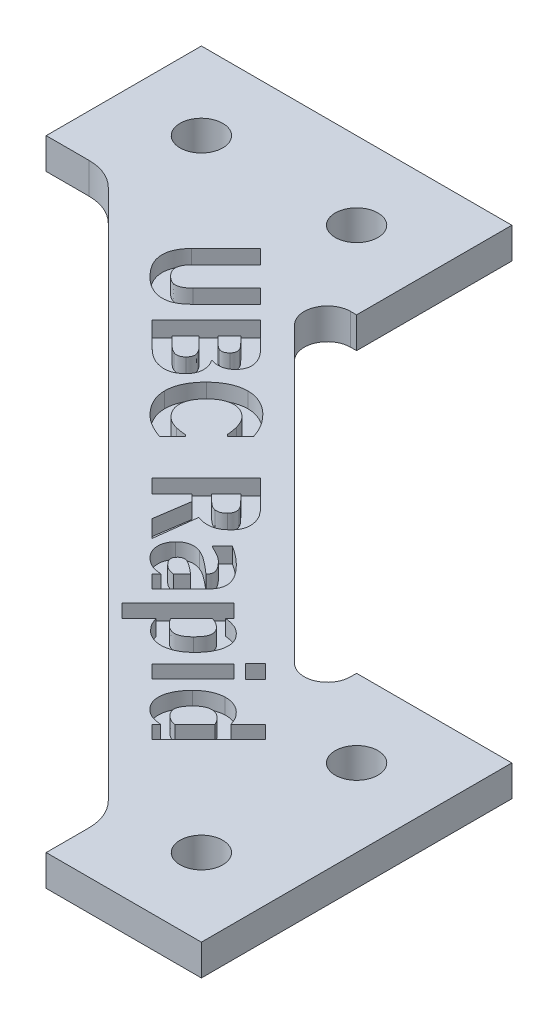
from build123d import *

# Parameters (mm, degrees)
SKETCH1_W           = 20
SKETCH1_H           = 40
SKETCH1_W_2         = 40
SKETCH1_H_2         = 20
BOSS_EXTRUDE1_DEPTH = 4
SKETCH2_R           = 2.75
CUT_EXTRUDE1_DEPTH  = 142.477913471
CUT_EXTRUDE2_DEPTH  = 2


with BuildPart() as part:
    # Sketch1 → Boss-Extrude1 (new body)
    with BuildSketch(Plane(origin=(0, 0, 0), x_dir=(1, 0, 0), z_dir=(0, 1, 0))):
        with Locations((90, -80)):
            Rectangle(SKETCH1_W, SKETCH1_H)
        with BuildLine():
            ThreePointArc((80, -60.757359313), (78.148050297, -63.52899791), (74.878679656, -62.878679656))
            Line((74.878679656, -62.878679656), (80, -68))
            Line((80, -68), (80, -60.757359313))
        make_face()
        with BuildLine():
            Line((39.242640687, -20), (32, -20))
            Line((32, -20), (37.121320344, -25.121320344))
            ThreePointArc((37.121320344, -25.121320344), (36.47100209, -21.851949703), (39.242640687, -20))
        make_face()
        with Locations((20, -10)):
            Rectangle(SKETCH1_W_2, SKETCH1_H_2)
        Polygon((32, -20), (8, -20), (9.757359313, -21.757359313), (78.242640687, -90.242640687), (80, -92), (80, -68), (74.878679656, -62.878679656), (37.121320344, -25.121320344), align=None)
        with BuildLine():
            Line((80, -92), (78.242640687, -90.242640687))
            ThreePointArc((78.242640687, -90.242640687), (79.543277195, -92.18918078), (80, -94.485281374))
            Line((80, -94.485281374), (80, -92))
        make_face()
        with BuildLine():
            Line((9.757359313, -21.757359313), (8, -20))
            Line((8, -20), (5.514718626, -20))
            ThreePointArc((5.514718626, -20), (7.81081922, -20.456722805), (9.757359313, -21.757359313))
        make_face()
    extrude(amount=BOSS_EXTRUDE1_DEPTH)

    # Sketch2 → Cut-Extrude1 (cut, through all)
    with BuildSketch(Plane(origin=(0, 4, 0), x_dir=(1, 0, 0), z_dir=(0, 1, 0))):
        with Locations(Location((10, -10, 0), (0, 0, 270))):
            Circle(SKETCH2_R)
        with Locations(Location((30, -10, 0), (0, 0, 90))):
            Circle(SKETCH2_R)
        with Locations(Location((90, -70, 0), (0, 0, 90))):
            Circle(SKETCH2_R)
        with Locations(Location((90, -90, 0), (0, 0, 270))):
            Circle(SKETCH2_R)
    extrude(amount=-CUT_EXTRUDE1_DEPTH, mode=Mode.SUBTRACT)

    # Sketch3 → Cut-Extrude2 (cut)
    # profile 1 of 9: a face of its own
    with BuildSketch(Plane(origin=(0, 4, 0), x_dir=(1, 0, 0), z_dir=(0, 1, 0))):
        with BuildLine():
            add(Edge.make_bspline(
                [(28.182713698, -29.462568309), (28.075826412, -29.565594319), (27.868035045, -29.765879274), (27.532483997, -30.023238662), (27.194157836, -30.241336385), (26.848110825, -30.414658569), (26.49630473, -30.54547332), (26.137168738, -30.628154218), (25.772966903, -30.670520752), (25.403567724, -30.668903822), (25.030883083, -30.61940988), (24.655298358, -30.529161756), (24.280021081, -30.387432231), (23.90299654, -30.204237164), (23.523932642, -29.977131592), (23.14408354, -29.70484041), (22.762828471, -29.386602114), (22.51797436, -29.149724143), (22.391574457, -29.027441727)],
                knots=[0, 0, 0, 0, 1.075048097, 2.089918463, 3.058740236, 3.988158132, 4.889005077, 5.772066947, 6.652099436, 7.54073972, 8.44147264, 9.370792297, 10.33369428, 11.34224759, 12.404942145, 13.531810066, 14.725857754, 16, 16, 16, 16], degree=3))
            add(Edge.make_bspline(
                [(22.391574457, -29.027441727), (22.26918736, -28.901131539), (22.031753692, -28.656086987), (21.714655191, -28.273184234), (21.4421211, -27.892573805), (21.212687483, -27.514549645), (21.029100468, -27.137413801), (20.890745343, -26.761878899), (20.799201737, -26.387595975), (20.750169654, -26.015411602), (20.748579513, -25.646755885), (20.790312635, -25.282836711), (20.876370536, -24.925987509), (21.003922961, -24.57377417), (21.17838776, -24.229656988), (21.39254205, -23.889298077), (21.654160795, -23.558145682), (21.852535617, -23.349465714), (21.954470027, -23.24223603)],
                knots=[0, 0, 0, 0, 1.275463152, 2.474426653, 3.6024628, 4.668718055, 5.678316933, 6.640566572, 7.566203481, 8.467870191, 9.35743173, 10.233625382, 11.118701708, 12.014349053, 12.944730479, 13.911994369, 14.927083492, 16, 16, 16, 16], degree=3))
            Line((21.954470027, -23.24223603), (26.420451039, -18.776255018))
            Line((26.420451039, -18.776255018), (28.234137748, -20.589941727))
            Line((28.234137748, -20.589941727), (23.871004837, -24.953074638))
            add(Edge.make_bspline(
                [(23.871004837, -24.953074638), (23.812727151, -25.012230592), (23.699566953, -25.12709616), (23.550490085, -25.307510914), (23.419440915, -25.483788055), (23.313296868, -25.660179972), (23.225246331, -25.833007422), (23.155614022, -26.003604653), (23.11334289, -26.174325902), (23.088005561, -26.342586622), (23.085727338, -26.510354411), (23.108106935, -26.678751581), (23.154657349, -26.847124445), (23.222244018, -27.016678137), (23.314986214, -27.185803778), (23.430285565, -27.355310663), (23.567616693, -27.526869158), (23.672308703, -27.63585397), (23.726621926, -27.692394258)],
                knots=[0, 0, 0, 0, 1.258812791, 2.444288983, 3.546242188, 4.587123115, 5.561938949, 6.486595306, 7.374179629, 8.222603272, 9.062559341, 9.909626779, 10.790086337, 11.705451614, 12.671821082, 13.708997538, 14.811449621, 16, 16, 16, 16], degree=3))
            add(Edge.make_bspline(
                [(23.726621926, -27.692394258), (23.781904516, -27.745953525), (23.889038122, -27.849747456), (24.057020516, -27.987137083), (24.226438061, -28.099478177), (24.392212887, -28.194827973), (24.559910239, -28.264330088), (24.726457383, -28.312443773), (24.892553909, -28.338672408), (25.058947933, -28.343300173), (25.226464981, -28.3224238), (25.396082312, -28.279768388), (25.570003772, -28.216509189), (25.744427452, -28.125507799), (25.924226638, -28.017011921), (26.103612899, -27.88232765), (26.288820691, -27.72818942), (26.408044335, -27.612161841), (26.469897242, -27.551967043)],
                knots=[0, 0, 0, 0, 1.163262994, 2.254318369, 3.274237978, 4.233489217, 5.140371775, 6.010992172, 6.848233164, 7.675629886, 8.518663367, 9.391220884, 10.315029615, 11.308909462, 12.360047292, 13.486220278, 14.695857804, 16, 16, 16, 16], degree=3))
            Line((26.469897242, -27.551967043), (30.833030153, -23.188834132))
            Line((30.833030153, -23.188834132), (32.644739014, -25.000542992))
            Line((32.644739014, -25.000542992), (28.182713698, -29.462568309))
        make_face()
    # profile 2 of 9: a face of its own
    with BuildSketch(Plane(origin=(0, 4, 0), x_dir=(1, 0, 0), z_dir=(0, 1, 0))):
        with BuildLine():
            add(Edge.make_bspline(
                [(35.529282906, -37.588409669), (35.444596875, -37.668168753), (35.278722914, -37.824392336), (35.005424607, -38.021567179), (34.719233324, -38.179355738), (34.421535479, -38.295871463), (34.11792203, -38.374928882), (33.811472993, -38.419455791), (33.502472766, -38.425855621), (33.298121601, -38.402935045), (33.195422146, -38.391415998)],
                knots=[0, 0, 0, 0, 1.08821971, 2.131488635, 3.145255233, 4.140131528, 5.116220295, 6.076391848, 7.033264583, 8, 8, 8, 8], degree=3))
            add(Edge.make_bspline(
                [(33.195422146, -38.391415998), (33.076208509, -38.371478429), (32.838993531, -38.331806038), (32.494305668, -38.228583592), (32.161011208, -38.095483925), (31.834910325, -37.926156686), (31.508443052, -37.71312349), (31.169011673, -37.455843226), (30.813389984, -37.148861849), (30.578770358, -36.919281427), (30.456102526, -36.799248277)],
                knots=[0, 0, 0, 0, 0.897497251, 1.785867744, 2.667470712, 3.561537888, 4.511502228, 5.560970237, 6.724784883, 8, 8, 8, 8], degree=3))
            Line((30.456102526, -36.799248277), (27.402305058, -33.745450808))
            Line((27.402305058, -33.745450808), (34.395975944, -26.751779922))
            Line((34.395975944, -26.751779922), (37.111561387, -29.467365365))
            add(Edge.make_bspline(
                [(37.111561387, -29.467365365), (37.179505754, -29.535892545), (37.310473668, -29.667983874), (37.499599949, -29.859972659), (37.670839755, -30.040851983), (37.824704019, -30.210543262), (37.967204433, -30.363168061), (38.088021361, -30.508974555), (38.198324917, -30.637904583), (38.319343048, -30.797560795), (38.457350079, -30.992367904), (38.59692883, -31.242641228), (38.723381844, -31.506652603), (38.789138098, -31.693079637), (38.822399994, -31.787381188)],
                knots=[0, 0, 0, 0, 1.192772616, 2.299159545, 3.330981206, 4.271072341, 5.130575059, 5.911039178, 6.611130747, 7.227219605, 8.386823748, 9.558278335, 10.764888683, 12, 12, 12, 12], degree=3))
            add(Edge.make_bspline(
                [(38.822399994, -31.787381188), (38.850774765, -31.885652657), (38.90608134, -32.077198112), (38.942695526, -32.368584948), (38.932125439, -32.652016481), (38.880856504, -32.926123705), (38.787903929, -33.189015457), (38.660816303, -33.440481875), (38.494273462, -33.678369836), (38.360729586, -33.82213809), (38.292336703, -33.895767264)],
                knots=[0, 0, 0, 0, 1.066936987, 2.079616111, 3.050875497, 4.017586551, 4.979875523, 5.952743723, 6.951522439, 8, 8, 8, 8], degree=3))
            add(Edge.make_bspline(
                [(38.292336703, -33.895767264), (38.206889278, -33.975012269), (38.039113127, -34.130609957), (37.752630467, -34.313431696), (37.44834807, -34.447895366), (37.128095867, -34.533029272), (36.795756978, -34.569702329), (36.455934239, -34.550228283), (36.108635935, -34.492043312), (35.88365939, -34.411593978), (35.768602526, -34.370450808)],
                knots=[0, 0, 0, 0, 1.023686706, 2.010010418, 2.973556204, 3.940187464, 4.914498294, 5.901691517, 6.926889055, 8, 8, 8, 8], degree=3))
            Line((35.768602526, -34.370450808), (35.731023412, -34.408029922))
            add(Edge.make_bspline(
                [(35.731023412, -34.408029922), (35.77484643, -34.476018538), (35.860876221, -34.609488271), (35.971161913, -34.816055942), (36.066154506, -35.022004077), (36.137411061, -35.230159622), (36.197581152, -35.43676674), (36.23313975, -35.644517738), (36.256879485, -35.851879702), (36.258350396, -36.059273663), (36.240841577, -36.264598498), (36.203237884, -36.466963772), (36.142977117, -36.664676873), (36.064457175, -36.859526343), (35.961382768, -37.048756193), (35.839300823, -37.234787822), (35.693216569, -37.415334882), (35.584799254, -37.529797668), (35.529282906, -37.588409669)],
                knots=[0, 0, 0, 0, 1.110252719, 2.179558029, 3.212729382, 4.220563916, 5.197974163, 6.163956265, 7.110700339, 8.061288682, 9.006299902, 9.936671773, 10.881813068, 11.840043678, 12.816153424, 13.835549873, 14.891668135, 16, 16, 16, 16], degree=3))
        make_face()
        with BuildLine():
            add(Edge.make_bspline(
                [(36.094947463, -32.402491947), (36.122897749, -32.372917714), (36.179280007, -32.313259575), (36.248156117, -32.208244071), (36.306890746, -32.093242518), (36.357676091, -31.969997434), (36.388895022, -31.835924412), (36.390487251, -31.693718932), (36.361086617, -31.546622616), (36.323933718, -31.451304384), (36.304599362, -31.401700808)],
                knots=[0, 0, 0, 0, 0.892992978, 1.801375479, 2.747691828, 3.72994455, 4.724943298, 5.753975974, 6.831169877, 8, 8, 8, 8], degree=3))
            add(Edge.make_bspline(
                [(36.304599362, -31.401700808), (36.281855083, -31.354997586), (36.234266501, -31.257278942), (36.139604539, -31.115964222), (36.02606202, -30.970999034), (35.889523138, -30.820100753), (35.726856951, -30.653640471), (35.537915057, -30.46019354), (35.317621169, -30.23875739), (35.161378434, -30.081181918), (35.078333539, -29.997428656)],
                knots=[0, 0, 0, 0, 0.665007447, 1.391416349, 2.173879375, 3.023514149, 3.997419956, 5.156412424, 6.488598948, 8, 8, 8, 8], degree=3))
            Line((35.078333539, -29.997428656), (34.91021645, -29.829311568))
            Line((34.91021645, -29.829311568), (33.43078607, -31.308741947))
            Line((33.43078607, -31.308741947), (33.711640501, -31.589596378))
            add(Edge.make_bspline(
                [(33.711640501, -31.589596378), (33.779812786, -31.658563188), (33.91092699, -31.791205483), (34.106022477, -31.975804692), (34.28345673, -32.146534267), (34.446813716, -32.299920598), (34.60062969, -32.431745594), (34.747214726, -32.539037344), (34.885324498, -32.624714575), (34.978926559, -32.664590225), (35.022953792, -32.683346378)],
                knots=[0, 0, 0, 0, 1.354798656, 2.605653396, 3.752317517, 4.795202836, 5.73639146, 6.580229613, 7.332188185, 8, 8, 8, 8], degree=3))
            add(Edge.make_bspline(
                [(35.022953792, -32.683346378), (35.079086238, -32.703895528), (35.184811387, -32.742599738), (35.343808288, -32.766032511), (35.489871585, -32.764613406), (35.624166849, -32.728972164), (35.746588744, -32.668525886), (35.867462649, -32.597211474), (35.98413299, -32.507353802), (36.05731218, -32.438105577), (36.094947463, -32.402491947)],
                knots=[0, 0, 0, 0, 1.20246249, 2.26483136, 3.222455025, 4.128579257, 5.03859663, 5.968880713, 6.95541683, 8, 8, 8, 8], degree=3))
        make_face(mode=Mode.SUBTRACT)
        with BuildLine():
            add(Edge.make_bspline(
                [(33.687906324, -35.69165334), (33.739585254, -35.637608573), (33.836823716, -35.53591858), (33.95148071, -35.370939928), (34.032934754, -35.210343576), (34.080117711, -35.048492826), (34.086057436, -34.881927699), (34.062207402, -34.706627899), (33.997883455, -34.522195911), (33.936018773, -34.400704658), (33.903491767, -34.336827391)],
                knots=[0, 0, 0, 0, 1.19063677, 2.240288014, 3.189807331, 4.05174976, 4.904154854, 5.82724429, 6.857615723, 8, 8, 8, 8], degree=3))
            add(Edge.make_bspline(
                [(33.903491767, -34.336827391), (33.875493149, -34.28868297), (33.815042708, -34.184736717), (33.694872727, -34.032467297), (33.552824642, -33.863273429), (33.321372585, -33.620171662), (33.00638604, -33.300951869), (32.749137216, -33.041295892), (32.617890501, -32.908821061)],
                knots=[0, 0, 0, 0, 0.519846961, 1.122376024, 1.808660073, 2.584526758, 4.257447246, 6, 6, 6, 6], degree=3))
            Line((32.617890501, -32.908821061), (32.224298729, -32.515229289))
            Line((32.224298729, -32.515229289), (30.479836703, -34.259691315))
            Line((30.479836703, -34.259691315), (30.610374678, -34.390229289))
            add(Edge.make_bspline(
                [(30.610374678, -34.390229289), (30.671675376, -34.451555264), (30.78966274, -34.569591279), (30.959924472, -34.739518232), (31.115946208, -34.896662036), (31.260507911, -35.037559002), (31.388949851, -35.167567577), (31.506316337, -35.28226151), (31.609905384, -35.383715436), (31.727877337, -35.50062591), (31.870445793, -35.62864739), (32.051045746, -35.758008274), (32.236894351, -35.871753652), (32.3685842, -35.928512029), (32.433950627, -35.956684985)],
                knots=[0, 0, 0, 0, 1.289764367, 2.482449696, 3.578055986, 4.583541365, 5.484989579, 6.296322604, 7.024448411, 7.641632681, 8.767113995, 9.869501852, 10.942492118, 12, 12, 12, 12], degree=3))
            add(Edge.make_bspline(
                [(32.433950627, -35.956684985), (32.497963799, -35.980957657), (32.61982762, -36.027166279), (32.803427265, -36.064383558), (32.975097802, -36.066888921), (33.13542815, -36.038837045), (33.2842367, -35.981338273), (33.426232436, -35.90447649), (33.56430848, -35.810451834), (33.646115086, -35.731821809), (33.687906324, -35.69165334)],
                knots=[0, 0, 0, 0, 1.193787919, 2.272650345, 3.25094577, 4.174288212, 5.095620263, 6.022398942, 6.989734444, 8, 8, 8, 8], degree=3))
        make_face(mode=Mode.SUBTRACT)
    # profile 3 of 9: a face of its own
    with BuildSketch(Plane(origin=(0, 4, 0), x_dir=(1, 0, 0), z_dir=(0, 1, 0))):
        with BuildLine():
            add(Edge.make_bspline(
                [(37.768002027, -44.384090816), (37.64309034, -44.253592838), (37.397362247, -43.996875312), (37.073666667, -43.583179603), (36.789593557, -43.158547533), (36.553093583, -42.720027839), (36.36016123, -42.27297941), (36.224934956, -41.817282259), (36.133098938, -41.357569681), (36.116752603, -41.047881031), (36.10858747, -40.893188917)],
                knots=[0, 0, 0, 0, 1.094069334, 2.152269169, 3.178306644, 4.186486617, 5.167449884, 6.122945076, 7.062395106, 8, 8, 8, 8], degree=3))
            add(Edge.make_bspline(
                [(36.10858747, -40.893188917), (36.110653783, -40.737315883), (36.114810131, -40.42378038), (36.192340899, -39.953248345), (36.321802977, -39.482926966), (36.505573955, -39.011584186), (36.7444705, -38.541214316), (37.050216226, -38.080292474), (37.407114668, -37.620414693), (37.683432974, -37.333877167), (37.825359622, -37.186701575)],
                knots=[0, 0, 0, 0, 0.890071919, 1.790361936, 2.716539851, 3.674670386, 4.677540803, 5.725992349, 6.831990949, 8, 8, 8, 8], degree=3))
            add(Edge.make_bspline(
                [(37.825359622, -37.186701575), (37.963634142, -37.054393555), (38.234623586, -36.795097217), (38.669511026, -36.455023845), (39.114732721, -36.163022268), (39.571843039, -35.923258317), (40.037666704, -35.734515093), (40.509097346, -35.596510328), (40.985537725, -35.510839386), (41.305377797, -35.496731214), (41.464600128, -35.489707904)],
                knots=[0, 0, 0, 0, 1.114696482, 2.184574413, 3.211847836, 4.213733522, 5.187587618, 6.135946941, 7.072039747, 8, 8, 8, 8], degree=3))
            add(Edge.make_bspline(
                [(41.464600128, -35.489707904), (41.618488373, -35.494162249), (41.928742668, -35.503142659), (42.393641466, -35.580604937), (42.857781046, -35.713376422), (43.31924803, -35.897653592), (43.774200662, -36.13142051), (44.215871314, -36.41325472), (44.642167009, -36.742514908), (44.904941565, -36.993697451), (45.038571647, -37.121432588)],
                knots=[0, 0, 0, 0, 0.915699714, 1.846143416, 2.796611282, 3.784899679, 4.799484072, 5.837105147, 6.900092073, 8, 8, 8, 8], degree=3))
            add(Edge.make_bspline(
                [(45.038571647, -37.121432588), (45.109554985, -37.19353232), (45.248308034, -37.334467616), (45.443998961, -37.547804719), (45.622750844, -37.757157827), (45.83134249, -38.027715528), (46.068135307, -38.352894562), (46.232835325, -38.621549125), (46.312305824, -38.751179423)],
                knots=[0, 0, 0, 0, 0.878022991, 1.71629526, 2.511910277, 3.266145923, 4.680869903, 6, 6, 6, 6], degree=3))
            add(Edge.make_bspline(
                [(46.312305824, -38.751179423), (46.38317534, -38.881254194), (46.519775165, -39.131971175), (46.678811537, -39.509388335), (46.81256564, -39.853375759), (46.890906561, -40.071566526), (46.927416584, -40.173252208)],
                knots=[0, 0, 0, 0, 1.145007103, 2.206982344, 3.164381589, 4, 4, 4, 4], degree=3))
            Line((46.927416584, -40.173252208), (45.230422913, -41.870245879))
            Line((45.230422913, -41.870245879), (45.024726711, -41.664549676))
            add(Edge.make_bspline(
                [(45.024726711, -41.664549676), (45.016650404, -41.573513638), (44.99888984, -41.373316751), (44.958559115, -41.050775399), (44.9064901, -40.68657555), (44.845003322, -40.435865186), (44.813096964, -40.305768031)],
                knots=[0, 0, 0, 0, 0.796483031, 1.751541763, 2.83324321, 4, 4, 4, 4], degree=3))
            add(Edge.make_bspline(
                [(44.813096964, -40.305768031), (44.773346446, -40.168845454), (44.692638694, -39.890843707), (44.542461341, -39.557562999), (44.405386211, -39.292271065), (44.275887429, -39.102307302), (44.132614445, -38.917212986), (44.023665228, -38.803011845), (43.968555824, -38.745245879)],
                knots=[0, 0, 0, 0, 1.427809267, 2.898962892, 3.655988263, 4.418619922, 5.200096009, 6, 6, 6, 6], degree=3))
            add(Edge.make_bspline(
                [(43.968555824, -38.745245879), (43.904221787, -38.684194187), (43.777197106, -38.563650351), (43.570924913, -38.401899952), (43.354642634, -38.260102947), (43.127287312, -38.138341145), (42.889269902, -38.037298115), (42.635858246, -37.967197914), (42.369468983, -37.920354861), (42.186711941, -37.91126939), (42.093555824, -37.906638284)],
                knots=[0, 0, 0, 0, 1.0095446, 1.993300671, 2.980317156, 3.951009153, 4.926999742, 5.918034008, 6.938766655, 8, 8, 8, 8], degree=3))
            add(Edge.make_bspline(
                [(42.093555824, -37.906638284), (42.001067423, -37.908221276), (41.812224331, -37.911453433), (41.525471628, -37.962054977), (41.231353776, -38.04686777), (40.927810326, -38.163619367), (40.617133752, -38.31932232), (40.30898618, -38.527709809), (39.994427959, -38.77445942), (39.79560188, -38.966186616), (39.69244823, -39.065657271)],
                knots=[0, 0, 0, 0, 0.809741328, 1.653332251, 2.542329821, 3.489908315, 4.500363904, 5.580584159, 6.744774441, 8, 8, 8, 8], degree=3))
            add(Edge.make_bspline(
                [(39.69244823, -39.065657271), (39.589687649, -39.172753243), (39.392281087, -39.37848824), (39.137428528, -39.702540237), (38.931185361, -40.023210509), (38.776134424, -40.341425424), (38.665090094, -40.650586371), (38.591364682, -40.948206614), (38.547914844, -41.234047122), (38.550144184, -41.421140644), (38.551229875, -41.512255372)],
                knots=[0, 0, 0, 0, 1.281333657, 2.461485438, 3.554629849, 4.568217049, 5.512030699, 6.386251039, 7.214102682, 8, 8, 8, 8], degree=3))
            add(Edge.make_bspline(
                [(38.551229875, -41.512255372), (38.558587836, -41.60150242), (38.573143845, -41.778056875), (38.627578494, -42.036848972), (38.708705117, -42.285780511), (38.818137472, -42.521913445), (38.947610729, -42.744273937), (39.087536284, -42.954276053), (39.239463813, -43.149541052), (39.35191407, -43.267492144), (39.407638103, -43.325942081)],
                knots=[0, 0, 0, 0, 1.046992734, 2.071230784, 3.086042369, 4.104337014, 5.109959263, 6.094138613, 7.055562123, 8, 8, 8, 8], degree=3))
            add(Edge.make_bspline(
                [(39.407638103, -43.325942081), (39.46346745, -43.379667107), (39.575120074, -43.487111315), (39.758173376, -43.630545017), (39.951399244, -43.762716464), (40.155788244, -43.879594874), (40.366365113, -43.984231874), (40.580915826, -44.073953865), (40.798032457, -44.146920927), (40.944848727, -44.185157662), (41.017606457, -44.204106638)],
                knots=[0, 0, 0, 0, 1.000936974, 2.001765114, 3.001576889, 4.024758029, 5.042316665, 6.039364515, 7.028367986, 8, 8, 8, 8], degree=3))
            add(Edge.make_bspline(
                [(41.017606457, -44.204106638), (41.138562452, -44.232877424), (41.376401455, -44.289450189), (41.725931635, -44.342023252), (42.042493171, -44.37353281), (42.239892462, -44.388987722), (42.328919749, -44.395957904)],
                knots=[0, 0, 0, 0, 1.123765204, 2.209689543, 3.192568117, 4, 4, 4, 4], degree=3))
            Line((42.328919749, -44.395957904), (42.516815318, -44.583853474))
            Line((42.516815318, -44.583853474), (40.843555824, -46.257112967))
            add(Edge.make_bspline(
                [(40.843555824, -46.257112967), (40.720446146, -46.208531522), (40.479688031, -46.113523743), (40.120619637, -45.980709071), (39.774443544, -45.82842799), (39.552007542, -45.711265746), (39.439283673, -45.651891448)],
                knots=[0, 0, 0, 0, 1.037663707, 2.02929584, 3.001306458, 4, 4, 4, 4], degree=3))
            add(Edge.make_bspline(
                [(39.439283673, -45.651891448), (39.298729862, -45.571503843), (39.028498362, -45.416949063), (38.701405124, -45.204727655), (38.448880717, -45.010091594), (38.239268128, -44.83446796), (38.01056453, -44.620942662), (37.852063723, -44.466173445), (37.768002027, -44.384090816)],
                knots=[0, 0, 0, 0, 1.383618265, 2.660171493, 3.327223395, 4.106962597, 4.996018138, 6, 6, 6, 6], degree=3))
        make_face()
    # profile 4 of 9: a face of its own
    with BuildSketch(Plane(origin=(0, 4, 0), x_dir=(1, 0, 0), z_dir=(0, 1, 0))):
        with BuildLine():
            Line((51.771771627, -58.114917377), (49.568448842, -55.911594592))
            Line((49.568448842, -55.911594592), (50.227072259, -51.439680035))
            Line((50.227072259, -51.439680035), (49.396376057, -50.608983833))
            Line((49.396376057, -50.608983833), (46.83110707, -53.17425282))
            Line((46.83110707, -53.17425282), (45.035220994, -51.378366744))
            Line((45.035220994, -51.378366744), (52.02889188, -44.384695858))
            Line((52.02889188, -44.384695858), (55.054999475, -47.410803453))
            add(Edge.make_bspline(
                [(55.054999475, -47.410803453), (55.154024488, -47.510914965), (55.344967401, -47.703952897), (55.608385843, -47.995420146), (55.841435047, -48.274214566), (56.050005535, -48.54082959), (56.227987205, -48.810212487), (56.376605457, -49.089166461), (56.497778023, -49.382495524), (56.553689003, -49.586404611), (56.581898209, -49.689284466)],
                knots=[0, 0, 0, 0, 1.215899583, 2.344532981, 3.391319554, 4.353562614, 5.266275611, 6.175537213, 7.079489447, 8, 8, 8, 8], degree=3))
            add(Edge.make_bspline(
                [(56.581898209, -49.689284466), (56.604864352, -49.793023004), (56.650147423, -49.997567557), (56.673712673, -50.310203467), (56.656438924, -50.619388569), (56.60692154, -50.92749393), (56.508832374, -51.231690465), (56.357713839, -51.529911177), (56.150929254, -51.820464216), (55.982906183, -51.999385081), (55.895584918, -52.092369909)],
                knots=[0, 0, 0, 0, 0.96967777, 1.911944297, 2.852669912, 3.793241298, 4.755032324, 5.759632957, 6.835685578, 8, 8, 8, 8], degree=3))
            add(Edge.make_bspline(
                [(55.895584918, -52.092369909), (55.83097565, -52.154394569), (55.704915971, -52.2754114), (55.50879663, -52.441140663), (55.308383524, -52.583661183), (55.105704376, -52.706457391), (54.902040581, -52.813087765), (54.69443169, -52.895906152), (54.48427103, -52.957530134), (54.272559559, -53.001241424), (54.056838066, -53.026659865), (53.838027201, -53.036606725), (53.614733086, -53.029902879), (53.386926707, -53.009983534), (53.154465258, -52.976438778), (52.917370531, -52.928514509), (52.676114375, -52.865747767), (52.515806588, -52.811951691), (52.43435074, -52.784616744)],
                knots=[0, 0, 0, 0, 1.143558393, 2.231206302, 3.275466946, 4.28039996, 5.255623228, 6.207714215, 7.129430578, 8.049106849, 8.964921512, 9.900377366, 10.84364281, 11.815480571, 12.819178524, 13.841211015, 14.903072703, 16, 16, 16, 16], degree=3))
            Line((52.43435074, -52.784616744), (51.771771627, -58.114917377))
        make_face()
        with BuildLine():
            add(Edge.make_bspline(
                [(53.808955171, -50.448778137), (53.850207368, -50.404847042), (53.929676079, -50.32021767), (54.028861561, -50.182027692), (54.101550614, -50.038723397), (54.155778757, -49.891974214), (54.18254711, -49.735777781), (54.176554098, -49.571224616), (54.145031859, -49.396521752), (54.101092342, -49.282555959), (54.077942513, -49.222512314)],
                knots=[0, 0, 0, 0, 1.07405713, 2.069076122, 3.020851128, 3.931960927, 4.850098842, 5.826252871, 6.854746705, 8, 8, 8, 8], degree=3))
            add(Edge.make_bspline(
                [(54.077942513, -49.222512314), (54.035507888, -49.134290872), (53.945839433, -48.947870457), (53.777102131, -48.739130038), (53.620212819, -48.566817139), (53.489816131, -48.422954369), (53.345177825, -48.273468782), (53.24406157, -48.171505372), (53.191866563, -48.118873073)],
                knots=[0, 0, 0, 0, 1.234348974, 2.608298414, 3.369870547, 4.184147347, 5.062678477, 6, 6, 6, 6], degree=3))
            Line((53.191866563, -48.118873073), (52.53917669, -47.4661832))
            Line((52.53917669, -47.4661832), (50.654287449, -49.35107244))
            Line((50.654287449, -49.35107244), (51.208084918, -49.904869909))
            add(Edge.make_bspline(
                [(51.208084918, -49.904869909), (51.277583587, -49.973179521), (51.41097674, -50.104290441), (51.608153407, -50.285710562), (51.792849686, -50.445587261), (51.967130043, -50.58315539), (52.135529425, -50.700437849), (52.308110798, -50.783783747), (52.478909171, -50.85218786), (52.59730419, -50.872084671), (52.655869728, -50.881926871)],
                knots=[0, 0, 0, 0, 1.316328873, 2.526512516, 3.619064736, 4.614997984, 5.526472787, 6.382804131, 7.200034371, 8, 8, 8, 8], degree=3))
            add(Edge.make_bspline(
                [(52.655869728, -50.881926871), (52.709877256, -50.887004363), (52.815137665, -50.89690037), (52.969690122, -50.892684893), (53.115097065, -50.873365424), (53.254490426, -50.836969877), (53.392203833, -50.778849112), (53.528288241, -50.690029877), (53.67180921, -50.582427795), (53.761796351, -50.494734722), (53.808955171, -50.448778137)],
                knots=[0, 0, 0, 0, 1.012139959, 1.97265583, 2.879697301, 3.745625871, 4.655669694, 5.656517296, 6.771870325, 8, 8, 8, 8], degree=3))
        make_face(mode=Mode.SUBTRACT)
    # profile 5 of 9: a face of its own
    with BuildSketch(Plane(origin=(0, 4, 0), x_dir=(1, 0, 0), z_dir=(0, 1, 0))):
        with BuildLine():
            add(Edge.make_bspline(
                [(56.304328766, -61.528012491), (56.21530596, -61.515592026), (56.01860072, -61.488147705), (55.712336601, -61.442936399), (55.398586408, -61.382792759), (55.19823568, -61.318843473), (55.103774968, -61.288692871)],
                knots=[0, 0, 0, 0, 0.879571074, 1.94350466, 3.030410241, 4, 4, 4, 4], degree=3))
            add(Edge.make_bspline(
                [(55.103774968, -61.288692871), (54.985779301, -61.239984996), (54.749135343, -61.142299847), (54.412711464, -60.94363686), (54.086871906, -60.69814211), (53.885434112, -60.505076788), (53.780594589, -60.40459477)],
                knots=[0, 0, 0, 0, 0.954214758, 1.913707187, 2.914176236, 4, 4, 4, 4], degree=3))
            add(Edge.make_bspline(
                [(53.780594589, -60.40459477), (53.720975132, -60.341486673), (53.603639823, -60.217285473), (53.446471417, -60.019316328), (53.313343362, -59.813249253), (53.204570237, -59.599812487), (53.114297579, -59.381351268), (53.046321011, -59.154917718), (53.003679131, -58.920714662), (52.981480299, -58.682400584), (52.983387237, -58.444505161), (53.00880115, -58.211765499), (53.058859278, -57.986400865), (53.131651897, -57.768575313), (53.229774414, -57.559227652), (53.351848971, -57.357838249), (53.497538585, -57.164123513), (53.610600921, -57.045146834), (53.667857247, -56.984895403)],
                knots=[0, 0, 0, 0, 1.088178554, 2.141612392, 3.164240082, 4.158718048, 5.14113333, 6.124487109, 7.116695124, 8.121018293, 9.121251071, 10.094336927, 11.050993431, 12.010324605, 12.968123216, 13.943453469, 14.958536463, 16, 16, 16, 16], degree=3))
            add(Edge.make_bspline(
                [(53.667857247, -56.984895403), (53.763268815, -56.895984566), (53.946245568, -56.725474674), (54.245614404, -56.519320566), (54.553683358, -56.376894843), (54.868220024, -56.290989307), (55.189032359, -56.264405249), (55.515976559, -56.276567172), (55.849654217, -56.342142088), (56.067768582, -56.416609032), (56.179724336, -56.454832111)],
                knots=[0, 0, 0, 0, 1.142156075, 2.190384393, 3.170333065, 4.103913611, 5.032562845, 5.981135572, 6.963738645, 8, 8, 8, 8], degree=3))
            add(Edge.make_bspline(
                [(56.179724336, -56.454832111), (56.296819464, -56.502689914), (56.540462069, -56.602268776), (56.898840183, -56.803041957), (57.273208081, -57.04040167), (57.787576924, -57.425749782), (58.446298499, -57.951452593), (58.960329068, -58.401611034), (59.221654715, -58.630465023)],
                knots=[0, 0, 0, 0, 0.605395335, 1.259660402, 1.963978638, 2.727603364, 4.336361257, 6, 6, 6, 6], degree=3))
            Line((59.221654715, -58.630465023), (59.249344589, -58.602775149))
            add(Edge.make_bspline(
                [(59.249344589, -58.602775149), (59.283027792, -58.566500324), (59.348213954, -58.496298668), (59.431337187, -58.383566139), (59.490073278, -58.265113422), (59.533980146, -58.146098136), (59.552705226, -58.022666255), (59.555388418, -57.897408612), (59.536645212, -57.768749729), (59.497902071, -57.637642295), (59.441622839, -57.503063562), (59.369456837, -57.36395784), (59.281866055, -57.219549642), (59.179179026, -57.06942375), (59.059445079, -56.915001424), (58.924671993, -56.754839188), (58.774283338, -56.588556442), (58.666271042, -56.478193713), (58.610499652, -56.421208694)],
                knots=[0, 0, 0, 0, 0.923175193, 1.786595171, 2.600521805, 3.382227109, 4.142355847, 4.917163474, 5.711914086, 6.556476153, 7.460785407, 8.428738558, 9.476871674, 10.609263067, 11.819376339, 13.119895118, 14.512878094, 16, 16, 16, 16], degree=3))
            add(Edge.make_bspline(
                [(58.610499652, -56.421208694), (58.537830562, -56.351959228), (58.389598121, -56.210702232), (58.140026533, -56.019914096), (57.866584113, -55.839176884), (57.575601542, -55.67813177), (57.293842384, -55.535287722), (57.046731221, -55.40647542), (56.839585863, -55.306459378), (56.715108065, -55.248245272), (56.660341424, -55.222632744)],
                knots=[0, 0, 0, 0, 1.046394325, 2.134464394, 3.271232355, 4.462859753, 5.600875083, 6.566606158, 7.369348058, 8, 8, 8, 8], degree=3))
            Line((56.660341424, -55.222632744), (56.506069272, -55.068360592))
            Line((56.506069272, -55.068360592), (57.777825601, -53.796604263))
            add(Edge.make_bspline(
                [(57.777825601, -53.796604263), (57.808272583, -53.814206033), (57.873087791, -53.851676492), (57.974086596, -53.915894096), (58.086829048, -53.989070892), (58.211119971, -54.07166072), (58.345785017, -54.165349939), (58.492212582, -54.268108166), (58.650308485, -54.381035738), (58.876796024, -54.54336395), (59.160931581, -54.759312712), (59.494618175, -55.030347959), (59.815214135, -55.31494084), (60.019507375, -55.514529117), (60.121575601, -55.614246668)],
                knots=[0, 0, 0, 0, 0.425879451, 0.906607604, 1.449198515, 2.053754496, 2.713765628, 3.43590696, 4.220215066, 5.066718465, 6.810550856, 8.541411631, 10.27203298, 12, 12, 12, 12], degree=3))
            add(Edge.make_bspline(
                [(60.121575601, -55.614246668), (60.236071237, -55.731223999), (60.457432231, -55.957382995), (60.759794893, -56.301287583), (61.024550924, -56.634179823), (61.250914773, -56.955848961), (61.438239284, -57.266736778), (61.587091889, -57.566457744), (61.694683352, -57.85631519), (61.766397392, -58.135983993), (61.798690123, -58.408717119), (61.794726222, -58.676032956), (61.755910619, -58.939436305), (61.675478586, -59.196869598), (61.565664208, -59.452047059), (61.413690568, -59.699207774), (61.231761774, -59.945569182), (61.086606086, -60.096949446), (61.011607247, -60.17516439)],
                knots=[0, 0, 0, 0, 1.478321933, 2.858124768, 4.134147436, 5.31867764, 6.408399607, 7.409798761, 8.336810394, 9.196186074, 10.011668021, 10.809743047, 11.604790665, 12.407341202, 13.23935487, 14.1074554, 15.022162685, 16, 16, 16, 16], degree=3))
            Line((61.011607247, -60.17516439), (57.421812943, -63.764958694))
            Line((57.421812943, -63.764958694), (55.744597753, -62.087743504))
            Line((55.744597753, -62.087743504), (56.304328766, -61.528012491))
        make_face()
        with BuildLine():
            Line((57.121180032, -60.711161225), (58.220863576, -59.611477681))
            add(Edge.make_bspline(
                [(58.220863576, -59.611477681), (58.090773693, -59.502809847), (57.82057546, -59.277105463), (57.474491844, -59.002938296), (57.196171301, -58.790876005), (57.006534723, -58.652619326), (56.836789477, -58.54289865), (56.727912591, -58.483546049), (56.678142057, -58.45641439)],
                knots=[0, 0, 0, 0, 1.58074262, 3.283221219, 4.116955542, 4.843843402, 5.47148993, 6, 6, 6, 6], degree=3))
            add(Edge.make_bspline(
                [(56.678142057, -58.45641439), (56.623957336, -58.430147238), (56.520405808, -58.379948517), (56.362004599, -58.326541643), (56.208471305, -58.300727274), (56.060151459, -58.297606166), (55.916776702, -58.321182258), (55.778855045, -58.375063622), (55.644699449, -58.456550049), (55.565978858, -58.53063782), (55.525056614, -58.569151732)],
                knots=[0, 0, 0, 0, 1.150143389, 2.19802009, 3.181906601, 4.114350404, 5.021597688, 5.938850879, 6.928528793, 8, 8, 8, 8], degree=3))
            add(Edge.make_bspline(
                [(55.525056614, -58.569151732), (55.476460641, -58.620168494), (55.388383804, -58.712632845), (55.296130354, -58.836063924), (55.248892557, -58.935838385), (55.229885555, -59.01644346), (55.221943206, -59.106386887), (55.226162183, -59.169103444), (55.228379399, -59.202063124)],
                knots=[0, 0, 0, 0, 1.739620706, 3.152942103, 3.779273227, 4.450317114, 5.185589009, 6, 6, 6, 6], degree=3))
            add(Edge.make_bspline(
                [(55.228379399, -59.202063124), (55.238200273, -59.269922236), (55.258251323, -59.408468612), (55.328152806, -59.578265722), (55.418211764, -59.715006493), (55.51158212, -59.835210073), (55.632095758, -59.970350252), (55.723083143, -60.063485231), (55.772287627, -60.113851099)],
                knots=[0, 0, 0, 0, 1.133333798, 2.313901331, 3.001717561, 3.842876704, 4.833463134, 6, 6, 6, 6], degree=3))
            add(Edge.make_bspline(
                [(55.772287627, -60.113851099), (55.816383405, -60.154923735), (55.904985212, -60.237451133), (56.053240968, -60.347157154), (56.215514664, -60.443248634), (56.388875987, -60.527683904), (56.569060875, -60.599282556), (56.75318352, -60.65071368), (56.936267112, -60.693444336), (57.059652012, -60.705266099), (57.121180032, -60.711161225)],
                knots=[0, 0, 0, 0, 0.961019581, 1.930980137, 2.935909423, 3.966286737, 5.005594029, 6.024359414, 7.014812569, 8, 8, 8, 8], degree=3))
        make_face(mode=Mode.SUBTRACT)
    # profile 6 of 9: a face of its own
    with BuildSketch(Plane(origin=(0, 4, 0), x_dir=(1, 0, 0), z_dir=(0, 1, 0))):
        with BuildLine():
            add(Edge.make_bspline(
                [(67.208893734, -68.132735687), (67.099767863, -68.236757244), (66.886255678, -68.440282493), (66.54348487, -68.709567894), (66.18934022, -68.937145055), (65.82795083, -69.124589085), (65.466457417, -69.273696836), (65.109925504, -69.381856129), (64.761321193, -69.457805434), (64.529922029, -69.473776923), (64.416172215, -69.481628092)],
                knots=[0, 0, 0, 0, 1.14035376, 2.231179652, 3.292598187, 4.321245726, 5.307903912, 6.246882172, 7.138212844, 8, 8, 8, 8], degree=3))
            add(Edge.make_bspline(
                [(64.416172215, -69.481628092), (64.300695712, -69.48361608), (64.072345431, -69.48754725), (63.735118898, -69.447279425), (63.408256911, -69.378649544), (63.093321229, -69.276399278), (62.793571932, -69.137773196), (62.507467583, -68.97212175), (62.237675308, -68.772697246), (62.074203337, -68.618396097), (61.991330443, -68.540172396)],
                knots=[0, 0, 0, 0, 1.033597438, 2.043898634, 3.034323796, 4.022351087, 5.002882811, 5.987497217, 6.979752135, 8, 8, 8, 8], degree=3))
            add(Edge.make_bspline(
                [(61.991330443, -68.540172396), (61.919807147, -68.466572391), (61.782376756, -68.325151651), (61.600000315, -68.107038505), (61.445707928, -67.894721556), (61.277493871, -67.613264757), (61.107766528, -67.238728863), (61.002928187, -66.926591023), (60.949004493, -66.766042649)],
                knots=[0, 0, 0, 0, 0.887050819, 1.704448049, 2.45586201, 3.153834197, 4.536072102, 6, 6, 6, 6], degree=3))
            Line((60.949004493, -66.766042649), (58.751615253, -68.963431889))
            Line((58.751615253, -68.963431889), (57.060555126, -67.272371763))
            Line((57.060555126, -67.272371763), (64.269811455, -60.063115434))
            Line((64.269811455, -60.063115434), (65.960871582, -61.75417556))
            Line((65.960871582, -61.75417556), (65.41102981, -62.304017332))
            add(Edge.make_bspline(
                [(65.41102981, -62.304017332), (65.5259716, -62.318390396), (65.752309622, -62.346693164), (66.083464788, -62.413555597), (66.402675523, -62.494191627), (66.711699604, -62.591826485), (67.01157691, -62.718556928), (67.299289096, -62.887439419), (67.580322138, -63.093050913), (67.751918419, -63.256615513), (67.839827278, -63.340409737)],
                knots=[0, 0, 0, 0, 1.030290692, 2.028800463, 3.003315154, 3.958628426, 4.90982706, 5.892761155, 6.920460506, 8, 8, 8, 8], degree=3))
            add(Edge.make_bspline(
                [(67.839827278, -63.340409737), (67.918121282, -63.422551739), (68.070612653, -63.582537764), (68.264110019, -63.843907099), (68.419327842, -64.115340425), (68.541582869, -64.394638995), (68.625455263, -64.683833349), (68.670837033, -64.98169644), (68.680221431, -65.288377605), (68.654395083, -65.602214417), (68.591671849, -65.920037052), (68.49675608, -66.238788184), (68.366479397, -66.55677812), (68.203545469, -66.874675356), (68.004191081, -67.191155168), (67.771643756, -67.507848613), (67.506364392, -67.825298939), (67.309778098, -68.028471417), (67.208893734, -68.132735687)],
                knots=[0, 0, 0, 0, 0.997184884, 1.942193301, 2.85112414, 3.741788968, 4.616979346, 5.491036068, 6.384319756, 7.309196359, 8.254044713, 9.228040043, 10.229261449, 11.271584755, 12.365452707, 13.514599177, 14.724539343, 16, 16, 16, 16], degree=3))
        make_face()
        with BuildLine():
            add(Edge.make_bspline(
                [(65.434763987, -66.421897079), (65.496133103, -66.359275838), (65.614772168, -66.23821616), (65.774801221, -66.05222129), (65.913468327, -65.871551785), (66.034236866, -65.698426637), (66.129208437, -65.526726099), (66.205322192, -65.361185232), (66.259825026, -65.200173391), (66.291987424, -65.043385402), (66.304993605, -64.889802105), (66.294180034, -64.737447252), (66.264370019, -64.586612596), (66.214656174, -64.436714601), (66.142193286, -64.289899304), (66.049687337, -64.144918785), (65.939267149, -63.999269958), (65.851794041, -63.90913272), (65.80659943, -63.862561636)],
                knots=[0, 0, 0, 0, 1.415558223, 2.736563831, 3.958815916, 5.092702758, 6.141212509, 7.122725539, 8.031697257, 8.879375889, 9.701603072, 10.512448438, 11.337153044, 12.178793524, 13.054876177, 13.973460349, 14.952950532, 16, 16, 16, 16], degree=3))
            add(Edge.make_bspline(
                [(65.80659943, -63.862561636), (65.721872638, -63.78440185), (65.54806217, -63.624063087), (65.238481914, -63.437175603), (64.906194226, -63.272502764), (64.666708003, -63.203108092), (64.546710189, -63.168336953)],
                knots=[0, 0, 0, 0, 0.948903946, 1.946603147, 2.971117712, 4, 4, 4, 4], degree=3))
            Line((64.546710189, -63.168336953), (61.892438037, -65.822609104))
            add(Edge.make_bspline(
                [(61.892438037, -65.822609104), (61.930439653, -65.899743498), (62.007976105, -66.057124368), (62.167643045, -66.271036944), (62.344614412, -66.473630247), (62.469431219, -66.603028297), (62.531282974, -66.667150244)],
                knots=[0, 0, 0, 0, 0.967416961, 1.973865564, 2.995968767, 4, 4, 4, 4], degree=3))
            add(Edge.make_bspline(
                [(62.531282974, -66.667150244), (62.586374038, -66.720316651), (62.693887531, -66.824074063), (62.865861678, -66.956867675), (63.036972958, -67.071001852), (63.211811236, -67.157143817), (63.387377655, -67.224736488), (63.565154194, -67.265988819), (63.744573808, -67.283847826), (63.92540861, -67.280390505), (64.108441727, -67.251374624), (64.293715637, -67.201814672), (64.480596649, -67.127701714), (64.667863915, -67.029210459), (64.859291141, -66.912468123), (65.051094029, -66.770759373), (65.244919403, -66.606408723), (65.370206878, -66.484640709), (65.434763987, -66.421897079)],
                knots=[0, 0, 0, 0, 1.098984287, 2.144733304, 3.116646778, 4.04841921, 4.938493575, 5.813732328, 6.660904052, 7.52292622, 8.404241143, 9.316264002, 10.272970409, 11.285293838, 12.352437127, 13.490866524, 14.707114155, 16, 16, 16, 16], degree=3))
        make_face(mode=Mode.SUBTRACT)
    # profile 7 of 9: a face of its own
    with BuildSketch(Plane(origin=(0, 4, 0), x_dir=(1, 0, 0), z_dir=(0, 1, 0))):
        Polygon((67.488496945, -73.831642696), (65.797436819, -72.140582569), (71.072357705, -66.865661683), (72.763417831, -68.55672181), align=None)
    # profile 8 of 9: a face of its own
    with BuildSketch(Plane(origin=(0, 4, 0), x_dir=(1, 0, 0), z_dir=(0, 1, 0))):
        Polygon((73.562468464, -67.852607885), (71.776471629, -66.06661105), (73.060095046, -64.782987632), (74.846091882, -66.568984468), align=None)
    # profile 9 of 9: a face of its own
    with BuildSketch(Plane(origin=(0, 4, 0), x_dir=(1, 0, 0), z_dir=(0, 1, 0))):
        with BuildLine():
            Line((74.237762882, -80.580908633), (72.546702756, -78.889848506))
            Line((72.546702756, -78.889848506), (73.096544528, -78.340006734))
            add(Edge.make_bspline(
                [(73.096544528, -78.340006734), (72.969063355, -78.32585973), (72.722919358, -78.298544323), (72.371269978, -78.232020376), (72.04887458, -78.154260699), (71.751959729, -78.057891994), (71.475131639, -77.929601839), (71.208151636, -77.770848482), (70.949610038, -77.572663689), (70.788351817, -77.419864076), (70.705326173, -77.341193443)],
                knots=[0, 0, 0, 0, 1.160237303, 2.240216661, 3.235675183, 4.160061346, 5.059628287, 5.990651135, 6.965463702, 8, 8, 8, 8], degree=3))
            add(Edge.make_bspline(
                [(70.705326173, -77.341193443), (70.628993086, -77.2603561), (70.479721147, -77.102275937), (70.290673628, -76.842616025), (70.137064463, -76.572641805), (70.01943314, -76.290891207), (69.935338915, -75.998340044), (69.888159873, -75.694048484), (69.876693033, -75.378826649), (69.901047187, -75.054602125), (69.960353022, -74.725932949), (70.0547876, -74.397065925), (70.181432035, -74.070476985), (70.343663777, -73.745884503), (70.539599264, -73.423782745), (70.771709498, -73.104777224), (71.033543258, -72.785347853), (71.229904135, -72.583083817), (71.330326173, -72.47964281)],
                knots=[0, 0, 0, 0, 0.967812533, 1.892590204, 2.790215823, 3.668091391, 4.546173609, 5.435677422, 6.343807285, 7.288262342, 8.262783433, 9.248160829, 10.264633631, 11.310048495, 12.405390149, 13.545113025, 14.744532224, 16, 16, 16, 16], degree=3))
            add(Edge.make_bspline(
                [(71.330326173, -72.47964281), (71.441291359, -72.372825978), (71.657500756, -72.164699412), (72.003567922, -71.893207539), (72.353935604, -71.663894805), (72.709830594, -71.479500505), (73.067412391, -71.333595571), (73.425492604, -71.227879541), (73.782724617, -71.152942929), (74.021843573, -71.134163172), (74.140848325, -71.124816861)],
                knots=[0, 0, 0, 0, 1.15711122, 2.254565875, 3.300567998, 4.300183679, 5.262741579, 6.198757811, 7.103557563, 8, 8, 8, 8], degree=3))
            add(Edge.make_bspline(
                [(74.140848325, -71.124816861), (74.252352784, -71.123002833), (74.475406588, -71.119374047), (74.809269834, -71.158565275), (75.140176338, -71.234201465), (75.463424066, -71.347254814), (75.774785017, -71.488673749), (76.065498124, -71.656059673), (76.332137726, -71.84914575), (76.490639759, -71.996686111), (76.569645794, -72.070228253)],
                knots=[0, 0, 0, 0, 0.998106751, 1.996615292, 3.00234594, 4.033319238, 5.058763216, 6.061611262, 7.03380161, 8, 8, 8, 8], degree=3))
            add(Edge.make_bspline(
                [(76.569645794, -72.070228253), (76.643860975, -72.146408689), (76.785715551, -72.292019644), (76.972487249, -72.515386718), (77.124759305, -72.731845613), (77.283056169, -73.012544798), (77.446708899, -73.375052334), (77.554640403, -73.673497496), (77.609993895, -73.826557367)],
                knots=[0, 0, 0, 0, 0.927425868, 1.772677786, 2.536808203, 3.23224388, 4.580535229, 6, 6, 6, 6], degree=3))
            Line((77.609993895, -73.826557367), (79.856829338, -71.579721924))
            Line((79.856829338, -71.579721924), (81.547889465, -73.270782051))
            Line((81.547889465, -73.270782051), (74.237762882, -80.580908633))
        make_face()
        with BuildLine():
            Line((74.002398958, -77.434152304), (76.591402123, -74.845149139))
            add(Edge.make_bspline(
                [(76.591402123, -74.845149139), (76.553900226, -74.761643607), (76.478353201, -74.593422925), (76.328745531, -74.363004599), (76.16875968, -74.151733529), (76.050557446, -74.026709038), (75.994091996, -73.966984582)],
                knots=[0, 0, 0, 0, 1.02686758, 2.068609812, 3.077370945, 4, 4, 4, 4], degree=3))
            add(Edge.make_bspline(
                [(75.994091996, -73.966984582), (75.938833665, -73.914704857), (75.831356805, -73.813021353), (75.6614887, -73.678728754), (75.486156159, -73.572814854), (75.310645751, -73.484703864), (75.130756523, -73.423900051), (74.948124605, -73.386054555), (74.763397789, -73.36871441), (74.576916298, -73.380837597), (74.389124963, -73.409951745), (74.201820629, -73.462184811), (74.0140941, -73.533729176), (73.82821894, -73.628015733), (73.642062739, -73.740600534), (73.457070297, -73.875184677), (73.271360885, -74.028384668), (73.153107162, -74.143457864), (73.092588832, -74.202348506)],
                knots=[0, 0, 0, 0, 1.101123079, 2.141672582, 3.127138832, 4.061985481, 4.979570121, 5.866869717, 6.757806747, 7.656278693, 8.564833684, 9.504927953, 10.465678728, 11.468782846, 12.518050972, 13.612077321, 14.777940441, 16, 16, 16, 16], degree=3))
            add(Edge.make_bspline(
                [(73.092588832, -74.202348506), (73.030504069, -74.265586236), (72.911091114, -74.387216792), (72.750399262, -74.575000896), (72.60924091, -74.755291887), (72.491856022, -74.933062001), (72.393663866, -75.104791032), (72.318134567, -75.273056794), (72.263679559, -75.435961588), (72.230844032, -75.594620324), (72.220485046, -75.750441218), (72.233245808, -75.904673824), (72.264884019, -76.058404224), (72.318742814, -76.211418108), (72.39577114, -76.362297855), (72.49064972, -76.513449186), (72.608713315, -76.66199571), (72.698248491, -76.756428325), (72.744487566, -76.805196608)],
                knots=[0, 0, 0, 0, 1.406035868, 2.70434954, 3.920280368, 5.03753482, 6.082277061, 7.056472467, 7.959762329, 8.803132058, 9.620931176, 10.429034326, 11.251904701, 12.105660115, 12.994718279, 13.935236591, 14.93368447, 16, 16, 16, 16], degree=3))
            add(Edge.make_bspline(
                [(72.744487566, -76.805196608), (72.784771965, -76.842803012), (72.867008793, -76.919572967), (73.004156238, -77.023911799), (73.155322202, -77.121683768), (73.373493463, -77.236724854), (73.653301532, -77.3578386), (73.888611196, -77.409277971), (74.002398958, -77.434152304)],
                knots=[0, 0, 0, 0, 0.695345929, 1.419483607, 2.172093988, 2.965216072, 4.532481563, 6, 6, 6, 6], degree=3))
        make_face(mode=Mode.SUBTRACT)
    extrude(amount=-CUT_EXTRUDE2_DEPTH, mode=Mode.SUBTRACT)


solid = part.part
